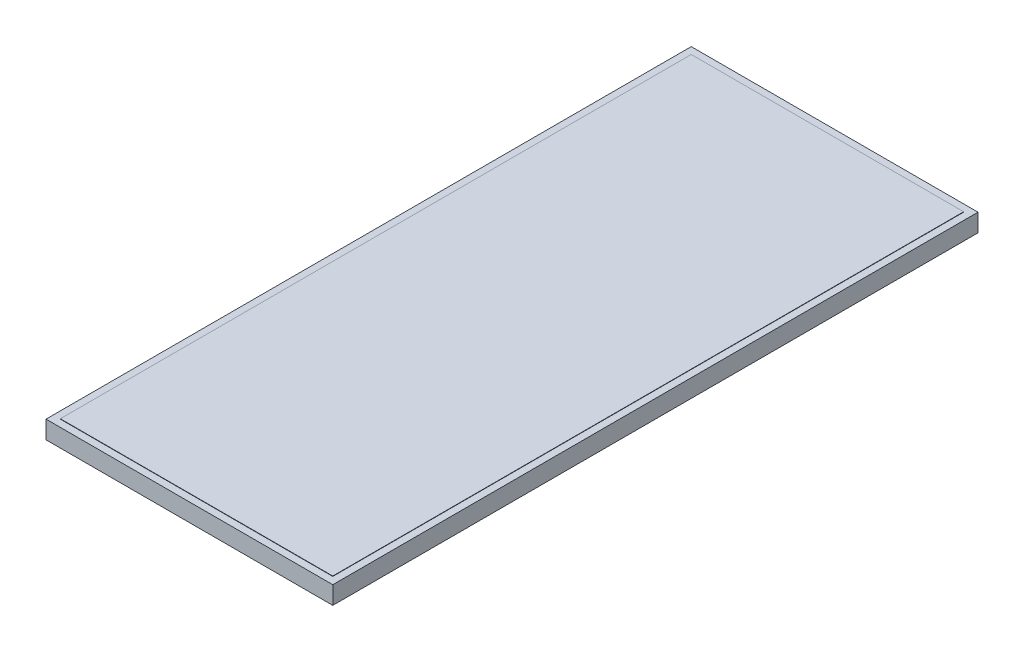
from build123d import *

# Parameters (mm, degrees)
SKETCH1_W           = 800
SKETCH1_H           = 1800
BOSS_EXTRUDE1_DEPTH = 50
SKETCH5_W           = 760
SKETCH5_H           = 1760
BOSS_EXTRUDE2_DEPTH = 1


with BuildPart() as part:
    # Sketch1 → Boss-Extrude1 (new body)
    with BuildSketch(Plane(origin=(0, 0, 0), x_dir=(1, 0, 0), z_dir=(0, 1, 0))):
        with Locations((400, 900)):
            Rectangle(SKETCH1_W, SKETCH1_H)
    extrude(amount=BOSS_EXTRUDE1_DEPTH)

    # Sketch5 → Boss-Extrude2 (add)
    with BuildSketch(Plane(origin=(0, 50, 0), x_dir=(1, 0, 0), z_dir=(0, 1, 0))):
        with Locations((400, 900)):
            Rectangle(SKETCH5_W, SKETCH5_H)
    extrude(amount=BOSS_EXTRUDE2_DEPTH)


solid = part.part
